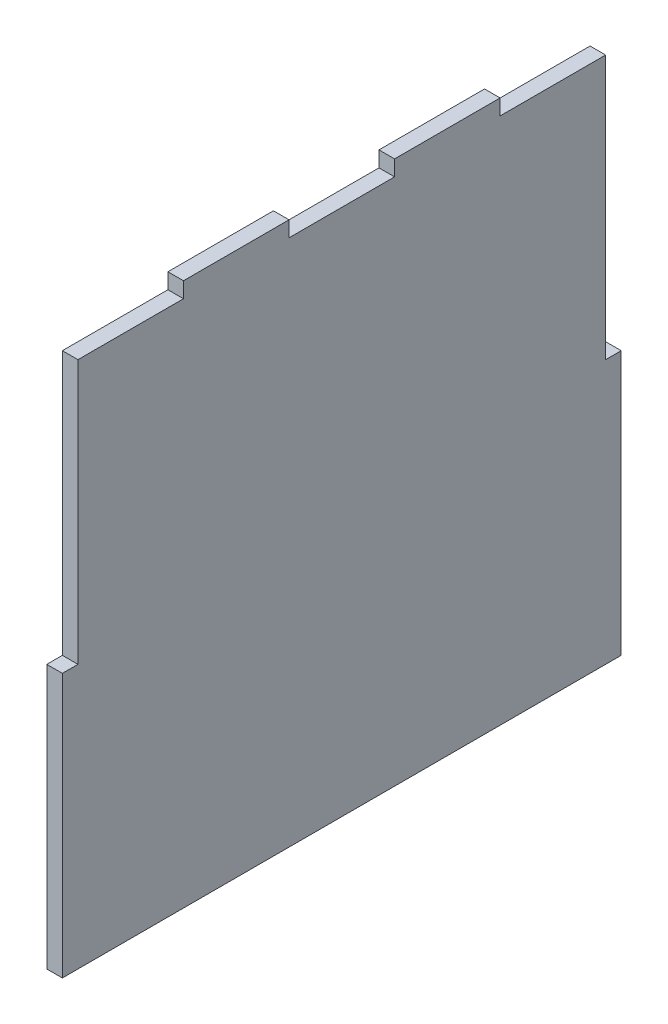
from build123d import *

# Parameters (mm, degrees)
SALIENTE_EXTRUIR1_DEPTH = 3


with BuildPart() as part:
    # Croquis1 → Saliente-Extruir1 (new body)
    with BuildSketch(Plane(origin=(0, 0, 0), x_dir=(0, 0, -1), z_dir=(1, 0, 0))):
        Polygon((0, 0), (0, 50.8), (3, 50.8), (3, 101.6), (23.32, 101.6), (23.32, 104.6), (43.64, 104.6), (43.64, 101.6), (63.96, 101.6), (63.96, 104.6), (84.28, 104.6), (84.28, 101.6), (104.6, 101.6), (104.6, 50.8), (107.6, 50.8), (107.6, 0), align=None)
    extrude(amount=SALIENTE_EXTRUIR1_DEPTH)


solid = part.part
